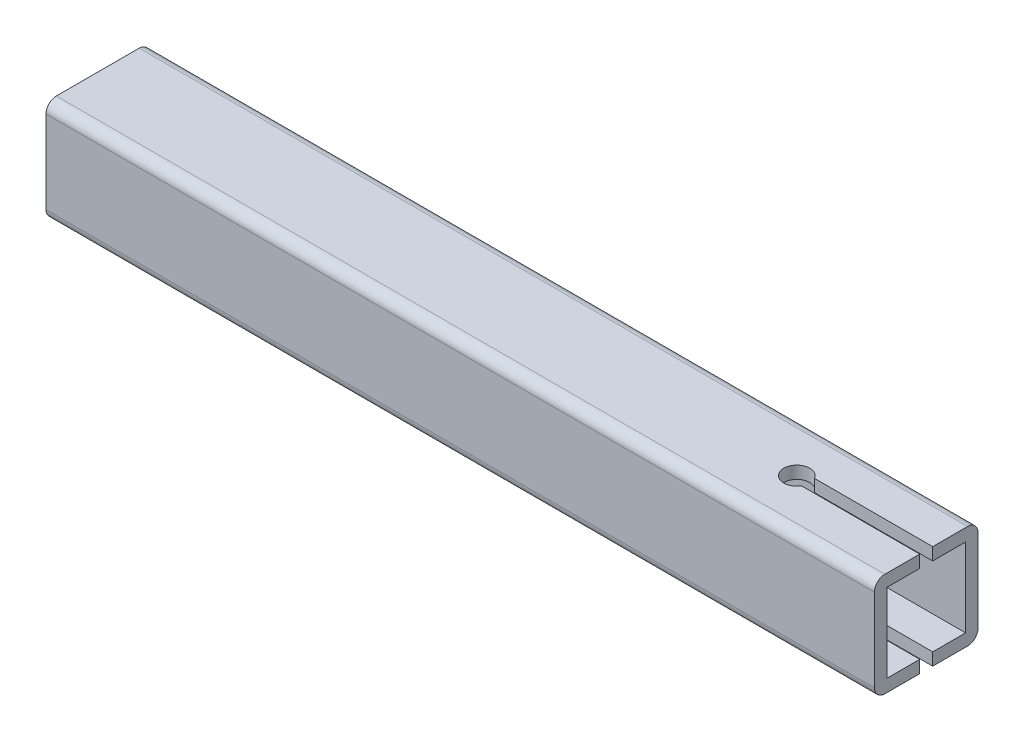
from build123d import *

# Parameters (mm, degrees)
SKETCH1_W               = 19.304
SKETCH1_H               = 19.304
BOSS_EXTRUDE1_DEPTH     = 203.2
CUT_EXTRUDE1_DEPTH      = 207.350575478
CUT_EXTRUDE1_DEPTH_BACK = 207.350575478


with BuildPart() as part:
    # Sketch1 → Boss-Extrude1 (new body)
    with BuildSketch(Plane(origin=(0, 0, 0), x_dir=(0, 0, -1), z_dir=(1, 0, 0))):
        with BuildLine():
            Line((0, 2.54), (0, 22.86))
            ThreePointArc((0, 22.86), (-0.743948776, 24.656051224), (-2.54, 25.4))
            Line((-2.54, 25.4), (-22.86, 25.4))
            ThreePointArc((-22.86, 25.4), (-24.656051224, 24.656051224), (-25.4, 22.86))
            Line((-25.4, 22.86), (-25.4, 2.54))
            ThreePointArc((-25.4, 2.54), (-24.656051224, 0.743948776), (-22.86, 0))
            Line((-22.86, 0), (-2.54, 0))
            ThreePointArc((-2.54, 0), (-0.743948776, 0.743948776), (0, 2.54))
        make_face()
        with Locations((-12.7, 12.7)):
            Rectangle(SKETCH1_W, SKETCH1_H, mode=Mode.SUBTRACT)
    extrude(amount=BOSS_EXTRUDE1_DEPTH)

    # Sketch2 → Cut-Extrude1 (cut, two sides: drawn at the far end of the back side and taken through both)
    with BuildSketch(Plane(origin=(0, 25.4, 0), x_dir=(1, 0, 0), z_dir=(0, 1, 0)).offset(-CUT_EXTRUDE1_DEPTH_BACK)):
        with BuildLine():
            Line((203.2, -11.1125), (174.199630657, -11.1125))
            ThreePointArc((174.199630657, -11.1125), (168.275, -12.7), (174.199630657, -14.2875))
            Line((174.199630657, -14.2875), (203.2, -14.2875))
            Line((203.2, -14.2875), (203.2, -11.1125))
        make_face()
    extrude(amount=CUT_EXTRUDE1_DEPTH + CUT_EXTRUDE1_DEPTH_BACK, mode=Mode.SUBTRACT)


solid = part.part
